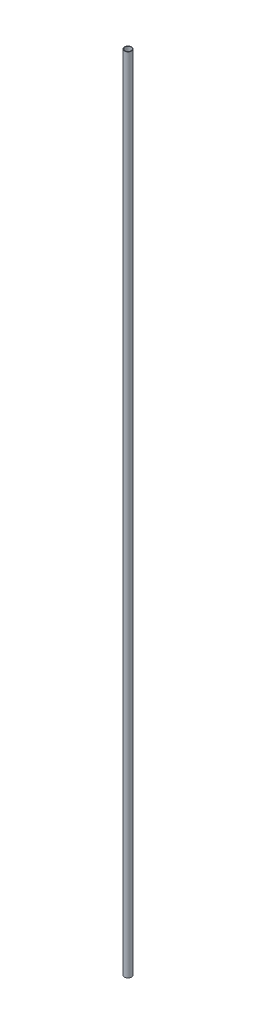
from build123d import *

# Parameters (mm, degrees)
SKETCH1_R           = 4
SKETCH1_R_2         = 3.5
BOSS_EXTRUDE1_DEPTH = 891.83


with BuildPart() as part:
    # Sketch1 → Boss-Extrude1 (new body)
    with BuildSketch(Plane(origin=(0, 0, 0), x_dir=(1, 0, 0), z_dir=(0, 1, 0))):
        with Locations(Location((0, 0, 0), (0, 0, 270))):
            Circle(SKETCH1_R)
        with Locations(Location((0, 0, 0), (0, 0, 270))):
            Circle(SKETCH1_R_2, mode=Mode.SUBTRACT)
    extrude(amount=BOSS_EXTRUDE1_DEPTH)


solid = part.part
